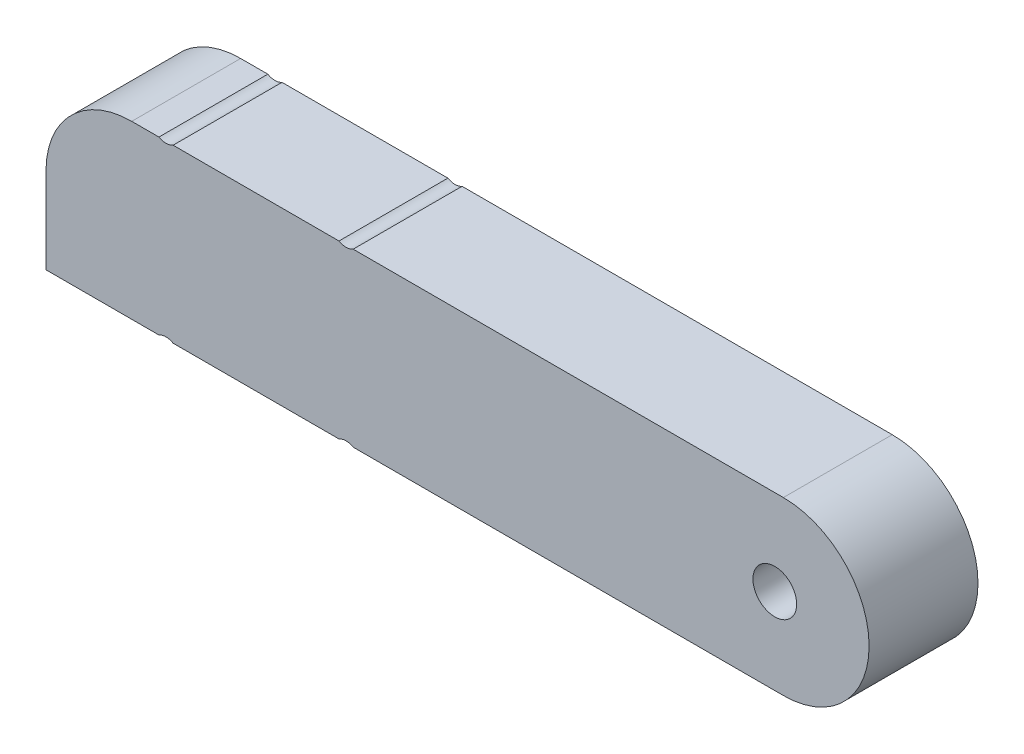
from build123d import *

# Parameters (mm, degrees)
SKETCH1_R           = 2.55
BOSS_EXTRUDE1_DEPTH = 12.7


with BuildPart() as part:
    # Sketch1 → Boss-Extrude1 (new body)
    with BuildSketch(Plane.XY):
        with BuildLine():
            Line((59.789213932, 216.60923387), (59.789213932, 206.609233872))
            Line((59.789213932, 206.609233872), (72.963032743, 206.609233872))
            ThreePointArc((72.963032743, 206.609233872), (73.789213933, 206.834833872), (74.615395122, 206.609233872))
            Line((74.615395122, 206.609233872), (93.963032742, 206.609233872))
            ThreePointArc((93.963032742, 206.609233872), (94.789213933, 206.834833872), (95.615395124, 206.609233871))
            Line((95.615395124, 206.609233871), (145.789213933, 206.609233871))
            ThreePointArc((145.789213933, 206.609233871), (155.789213933, 216.609233871), (145.789213933, 226.609233871))
            Line((145.789213933, 226.609233871), (95.615395124, 226.609233871))
            ThreePointArc((95.615395124, 226.609233871), (94.789213933, 226.38363387), (93.963032742, 226.60923387))
            Line((93.963032742, 226.60923387), (74.615395122, 226.60923387))
            ThreePointArc((74.615395122, 226.60923387), (73.789213933, 226.38363387), (72.963032743, 226.60923387))
            Line((72.963032743, 226.60923387), (69.789213932, 226.60923387))
            ThreePointArc((69.789213932, 226.60923387), (62.71814612, 223.680301682), (59.789213932, 216.60923387))
        make_face()
        with Locations((144.789213934, 216.609233872)):
            Circle(SKETCH1_R, mode=Mode.SUBTRACT)
    extrude(amount=BOSS_EXTRUDE1_DEPTH)


solid = part.part
